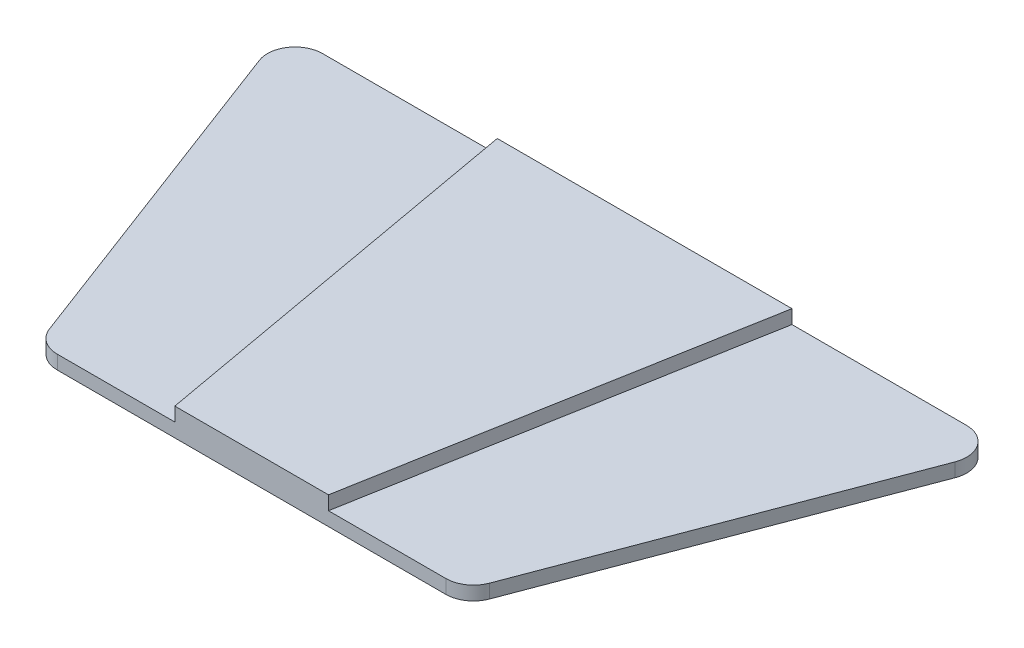
from build123d import *

# Parameters (mm, degrees)
EXTRUDE1_DEPTH = 2.286
EXTRUDE2_DEPTH = 2.286


with BuildPart() as part:
    # Sketch1 → Extrude1 (new body)
    with BuildSketch(Plane(origin=(0, 0, 0), x_dir=(1, 0, 0), z_dir=(0, 1, 0))):
        with BuildLine():
            Line((-53.408275127, 37.75591133), (53.408275127, 37.75591133))
            ThreePointArc((53.408275127, 37.75591133), (57.169709098, 35.782910846), (57.684725289, 31.566766311))
            Line((57.684725289, 31.566766311), (36.497605157, -24.461395817))
            ThreePointArc((36.497605157, -24.461395817), (34.820154512, -26.605684768), (32.221154995, -27.416250797))
            Line((32.221154995, -27.416250797), (-32.221154995, -27.416250797))
            ThreePointArc((-32.221154995, -27.416250797), (-34.820154512, -26.605684768), (-36.497605157, -24.461395817))
            Line((-36.497605157, -24.461395817), (-57.684725289, 31.566766311))
            ThreePointArc((-57.684725289, 31.566766311), (-57.169709098, 35.782910846), (-53.408275127, 37.75591133))
        make_face()
    extrude(amount=-EXTRUDE1_DEPTH)

    # Sketch2 → Extrude2 (add)
    with BuildSketch(Plane(origin=(0, 0, 0), x_dir=(1, 0, 0), z_dir=(0, 1, 0))):
        Polygon((-12.739414216, -27.416250797), (12.739414216, -27.416250797), (24.438876252, 37.75591133), (-24.438876252, 37.75591133), align=None)
    extrude(amount=EXTRUDE2_DEPTH)


solid = part.part
